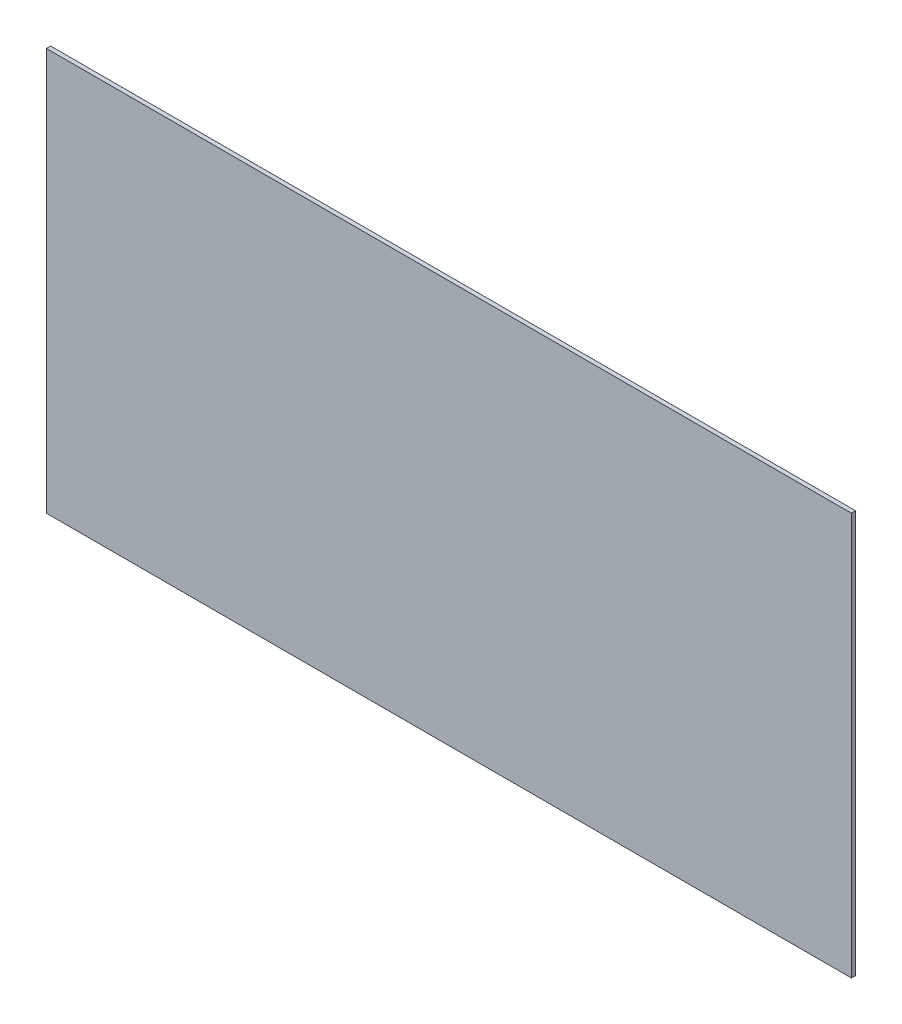
from build123d import *

# Parameters (mm, degrees)
SKETCH3_W           = 609.6
SKETCH3_H           = 304.8
BOSS_EXTRUDE1_DEPTH = 1.5875


with BuildPart() as part:
    # Sketch3 → Boss-Extrude1 (new, symmetric)
    with BuildSketch(Plane.XY):
        Rectangle(SKETCH3_W, SKETCH3_H)
    extrude(amount=BOSS_EXTRUDE1_DEPTH, both=True)


solid = part.part
